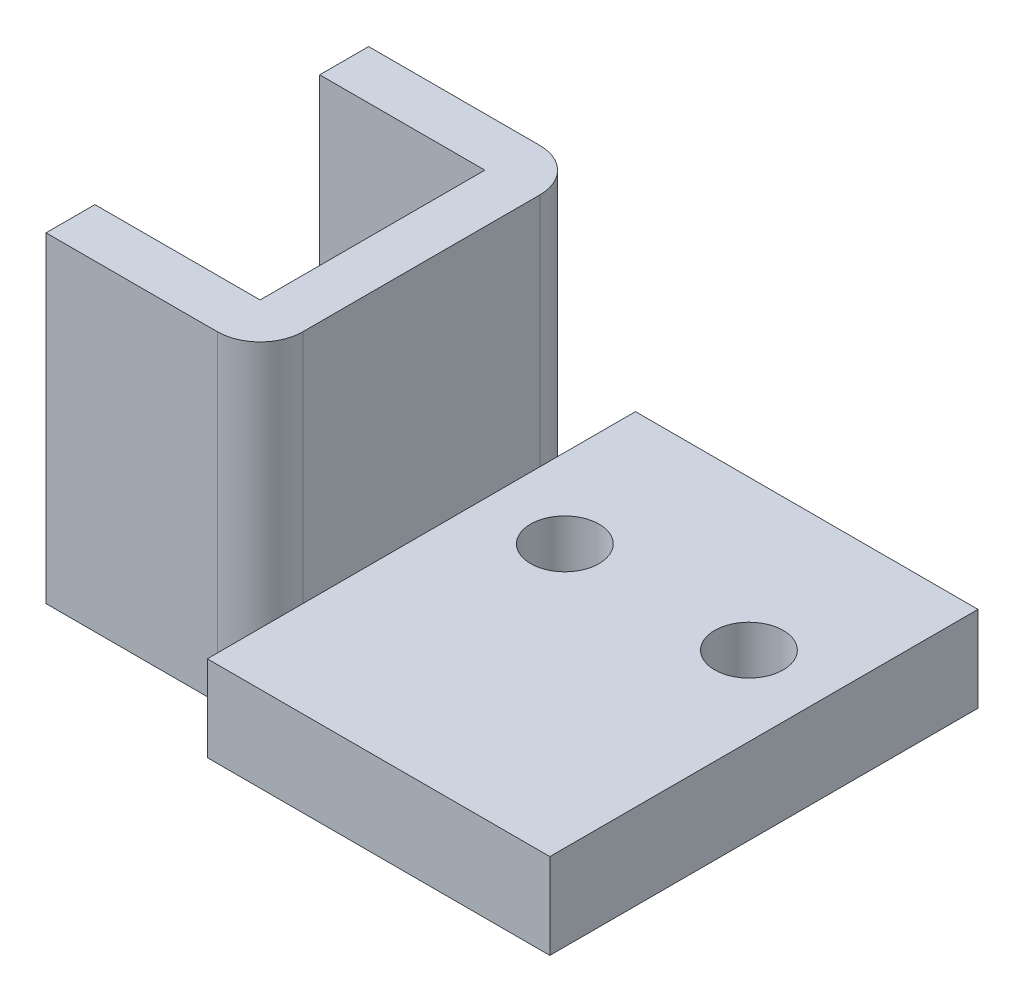
from build123d import *

# Parameters (mm, degrees)
EXTRUDE_3_DEPTH     = 15
EXTRUDE_4_DEPTH     = 4
SKETCH_8_R          = 1.6
CUT_EXTRUDE_1_DEPTH = 27.665153141


with BuildPart() as part:
    # 草图3 → 凸台-拉伸3 (new body)
    with BuildSketch(Plane(origin=(0, 0, 0), x_dir=(1, 0, 0), z_dir=(0, 1, 0))):
        with BuildLine():
            Line((1.616451797, 11.860683611), (-6.383548203, 11.860683611))
            Line((-6.383548203, 11.860683611), (-6.383548203, 9.575683611))
            Line((-6.383548203, 9.575683611), (1.331451797, 9.575683611))
            Line((1.331451797, 9.575683611), (1.331451797, -0.924316389))
            Line((1.331451797, -0.924316389), (-6.383548203, -0.924316389))
            Line((-6.383548203, -0.924316389), (-6.383548203, -3.209316389))
            Line((-6.383548203, -3.209316389), (1.616451797, -3.209316389))
            ThreePointArc((1.616451797, -3.209316389), (3.030665359, -2.623529952), (3.616451797, -1.209316389))
            Line((3.616451797, -1.209316389), (3.616451797, 9.860683611))
            ThreePointArc((3.616451797, 9.860683611), (3.030665359, 11.274897173), (1.616451797, 11.860683611))
        make_face()
    extrude(amount=EXTRUDE_3_DEPTH)

    # 草图3<4> → 凸台-拉伸4 (add)
    with BuildSketch(Plane(origin=(0, 0, 0), x_dir=(1, 0, 0), z_dir=(0, 1, 0))):
        Polygon((3.616451797, 14.325683611), (3.616451797, 9.860683611), (3.616451797, -1.209316389), (3.616451797, -5.674316389), (19.616451797, -5.674316389), (19.616451797, 14.325683611), align=None)
    extrude(amount=EXTRUDE_4_DEPTH)

    # 草图8 → 切除-拉伸1 (cut, through all)
    with BuildSketch(Plane(origin=(0, 4, 0), x_dir=(1, 0, 0), z_dir=(0, 1, 0))):
        with Locations((7.316451797, 7.325683611)):
            Circle(SKETCH_8_R)
        with Locations((15.916451797, 7.325683611)):
            Circle(SKETCH_8_R)
    extrude(amount=-CUT_EXTRUDE_1_DEPTH, mode=Mode.SUBTRACT)


solid = part.part
